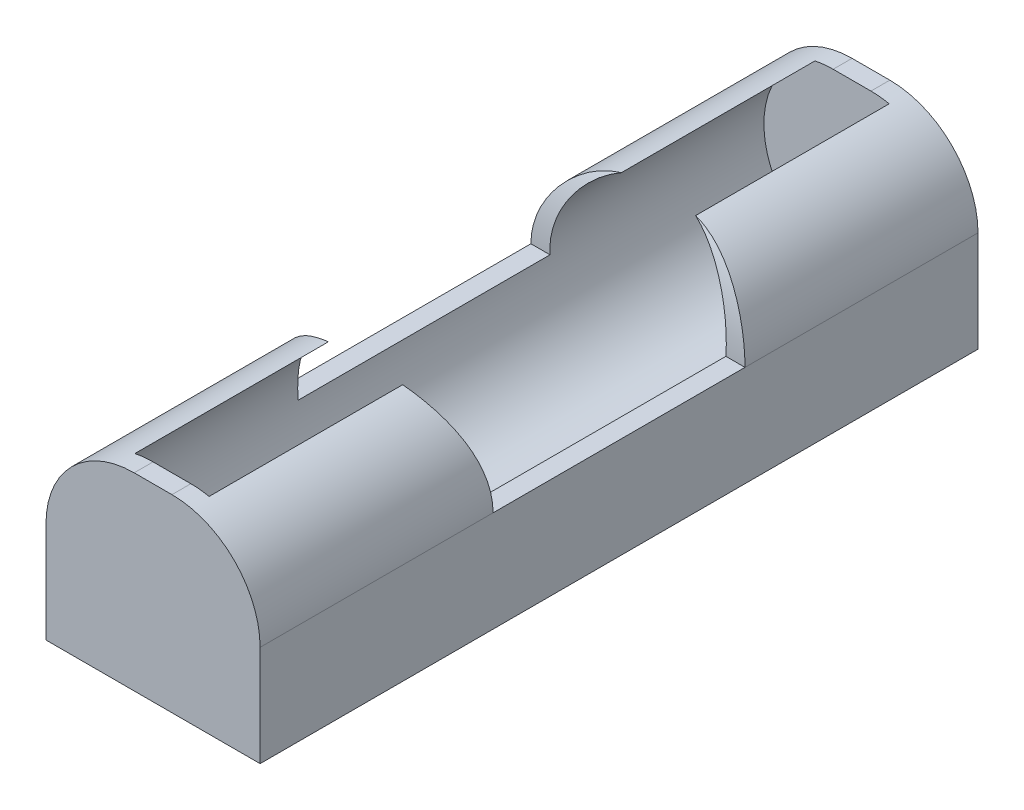
from build123d import *

# Parameters (mm, degrees)
SKETCH1_W           = 47
SKETCH1_H           = 55.5
BOSS_EXTRUDE1_DEPTH = 15
CUT_EXTRUDE4_DEPTH  = 54
FILLET1_R           = 7
FILLET2_R           = 7
SKETCH3_W           = 4.401923789
SKETCH3_H           = 6.5
CUT_EXTRUDE5_DEPTH  = 54
SKETCH4_W           = 1
SKETCH4_H           = 1
CUT_EXTRUDE6_DEPTH  = 54
CUT_EXTRUDE7_DEPTH  = 20
CUT_EXTRUDE8_DEPTH  = 5
BOSS_EXTRUDE3_DEPTH = 1.5
CUT_EXTRUDE9_DEPTH  = 57
SKETCH11_W          = 23.5
SKETCH11_H          = 15
CUT_EXTRUDE10_DEPTH = 68.067130548
SKETCH12_W          = 7.286258621
SKETCH12_H          = 11.383570635
BOSS_EXTRUDE4_DEPTH = 10
CUT_EXTRUDE11_DEPTH = 62.343296292


with BuildPart() as part:
    # Sketch1 → Boss-Extrude1 (new body)
    with BuildSketch(Plane(origin=(0, 0, 0), x_dir=(1, 0, 0), z_dir=(0, 1, 0))):
        with Locations((23.5, -27.75)):
            Rectangle(SKETCH1_W, SKETCH1_H)
    extrude(amount=BOSS_EXTRUDE1_DEPTH)

    # Sketch2 → Cut-Extrude4 (cut)
    with BuildSketch(Plane.XY.offset(55.5)):
        with BuildLine():
            Line((11.098076211, 15), (5.901923789, 15))
            ThreePointArc((5.901923789, 15), (8.5, 1.5), (11.098076211, 15))
        make_face()
        with BuildLine():
            Line((26.098076211, 15), (20.901923789, 15))
            ThreePointArc((20.901923789, 15), (23.5, 1.5), (26.098076211, 15))
        make_face()
        with BuildLine():
            ThreePointArc((35.901923789, 15), (38.5, 1.5), (41.098076211, 15))
            Line((41.098076211, 15), (35.901923789, 15))
        make_face()
    extrude(amount=-CUT_EXTRUDE4_DEPTH, mode=Mode.SUBTRACT)

    # Fillet1
    fillet1_edges = [part.edges().sort_by_distance(p)[0] for p in [
        (47, 15, 27.75),
    ]]
    fillet(fillet1_edges, radius=FILLET1_R)

    # Fillet2
    fillet2_edges = [part.edges().sort_by_distance(p)[0] for p in [
        (0, 15, 27.75),
    ]]
    fillet(fillet2_edges, radius=FILLET2_R)

    # Sketch3 → Cut-Extrude5 (cut)
    with BuildSketch(Plane.XY.offset(55.5)):
        with Locations((28.299038106, 11.75)):
            Rectangle(SKETCH3_W, SKETCH3_H)
        with Locations((33.700961895, 11.75)):
            Rectangle(SKETCH3_W, SKETCH3_H)
        with Locations((13.299038106, 11.75)):
            Rectangle(SKETCH3_W, SKETCH3_H)
        with Locations((18.700961895, 11.75)):
            Rectangle(SKETCH3_W, SKETCH3_H)
    extrude(amount=-CUT_EXTRUDE5_DEPTH, mode=Mode.SUBTRACT)

    # Sketch4 → Cut-Extrude6 (cut)
    with BuildSketch(Plane.XY.offset(55.5)):
        with Locations((16, 14.5)):
            Rectangle(SKETCH4_W, SKETCH4_H)
        with Locations((31, 14.5)):
            Rectangle(SKETCH4_W, SKETCH4_H)
    extrude(amount=-CUT_EXTRUDE6_DEPTH, mode=Mode.SUBTRACT)

    # Sketch5 → Cut-Extrude7 (cut)
    with BuildSketch(Plane.ZY.offset(-15.5)):
        Polygon((6.5, 14), (50.5, 14), (40.5, 7), (16.5, 7), align=None)
    extrude(amount=-CUT_EXTRUDE7_DEPTH, mode=Mode.SUBTRACT)

    # Sketch5<2> → Cut-Extrude8 (cut)
    with BuildSketch(Plane.ZY.offset(-15.5)):
        Polygon((6.5, 14), (50.5, 14), (40.5, 7), (16.5, 7), align=None)
    extrude(amount=CUT_EXTRUDE8_DEPTH, mode=Mode.SUBTRACT)

    # Sketch6 → Boss-Extrude3 (add)
    with BuildSketch(Plane.XY.offset(55.5)):
        with BuildLine():
            Line((0, 0), (47, 0))
            Line((47, 0), (47, 8))
            ThreePointArc((47, 8), (44.949747468, 12.949747468), (40, 15))
            Line((40, 15), (7, 15))
            ThreePointArc((7, 15), (2.050252532, 12.949747468), (0, 8))
            Line((0, 8), (0, 0))
        make_face()
    extrude(amount=BOSS_EXTRUDE3_DEPTH)

    # Sketch7 → Cut-Extrude9 (cut)
    with BuildSketch(Plane.XY.offset(57)):
        Polygon((16, 8), (16, 15), (47, 15), (47, 0), (16, 0), align=None)
    extrude(amount=-CUT_EXTRUDE9_DEPTH, mode=Mode.SUBTRACT)

    # Mirror1: part across plane


with BuildPart() as part_1:
    add(part.part)
    add(part.part.mirror(Plane(origin=(16, 8, 0), x_dir=(0, 0, 1), z_dir=(-1, 0, 0))))

    # Sketch11 → Cut-Extrude10 (cut, through all)
    with BuildSketch(Plane.XY.offset(57)):
        with Locations((20.25, 7.5)):
            Rectangle(SKETCH11_W, SKETCH11_H)
    extrude(amount=-CUT_EXTRUDE10_DEPTH, mode=Mode.SUBTRACT)


with BuildPart() as body_2:
    # Sketch12 → Boss-Extrude4 (new body)
    with BuildSketch(Plane.XY.offset(57)):
        with Locations((18.969587134, 9.308214683)):
            Rectangle(SKETCH12_W, SKETCH12_H)
    extrude(amount=BOSS_EXTRUDE4_DEPTH)


with BuildPart() as body_3:
    # Mirror2: mirrored copy
    add(part_1.part.mirror(Plane(origin=(8.5, 15, 0), x_dir=(0, 0, 1), z_dir=(-1, 0, 0))))


with BuildPart() as part_2:
    add(part_1.part)

    # Combine1: union body 3
    add(body_3.part)

    # Sketch13 → Cut-Extrude11 (cut, through all)
    with BuildSketch(Plane(origin=(17, 0, 0), x_dir=(0, 0, -1), z_dir=(1, 0, 0))):
        with BuildLine():
            Line((-38.5, 8), (-18.5, 8))
            ThreePointArc((-18.5, 8), (-15.125235033, 17.548269454), (-6.5, 22.855227978))
            Line((-6.5, 22.855227978), (-18.5, 22.855227978))
            Line((-18.5, 22.855227978), (-38.5, 22.855227978))
            Line((-38.5, 22.855227978), (-50.5, 22.855227978))
            ThreePointArc((-50.5, 22.855227978), (-41.874764967, 17.548269454), (-38.5, 8))
        make_face()
    extrude(amount=-CUT_EXTRUDE11_DEPTH, mode=Mode.SUBTRACT)


solid = part_2.part
